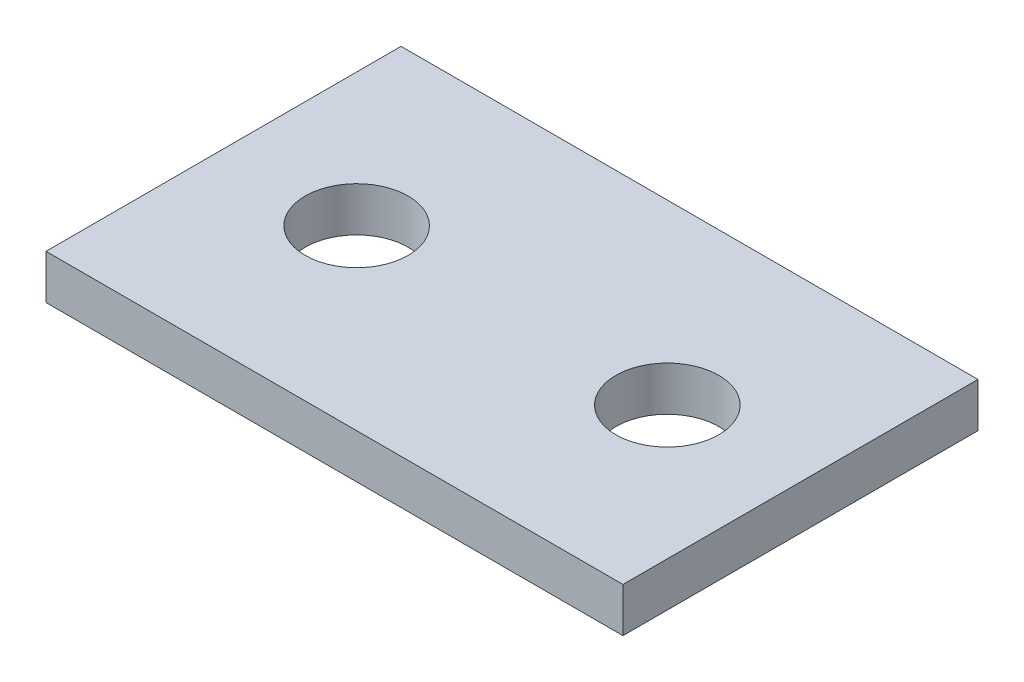
from build123d import *

# Parameters (mm, degrees)
SKETCH2_W                   = 82.55
SKETCH2_H                   = 50.8
BOSS_EXTRUDE1_DEPTH         = 3.175
F_1_2_0_58_DIAMETER_HOLE1_D = 14.732


with BuildPart() as part:
    # Sketch2 → Boss-Extrude1 (new, symmetric)
    with BuildSketch(Plane(origin=(0, 0, 0), x_dir=(1, 0, 0), z_dir=(0, 1, 0))):
        Rectangle(SKETCH2_W, SKETCH2_H)
    extrude(amount=BOSS_EXTRUDE1_DEPTH, both=True)

    # 1/2 (0.58) Diameter Hole1 (through all)
    with Locations(Plane(origin=(0, 3.175, 0), x_dir=(1, 0, 0), z_dir=(0, 1, 0))):
        with Locations((-22.225, 0), (22.225, 0)):
            Hole(F_1_2_0_58_DIAMETER_HOLE1_D / 2)


solid = part.part
